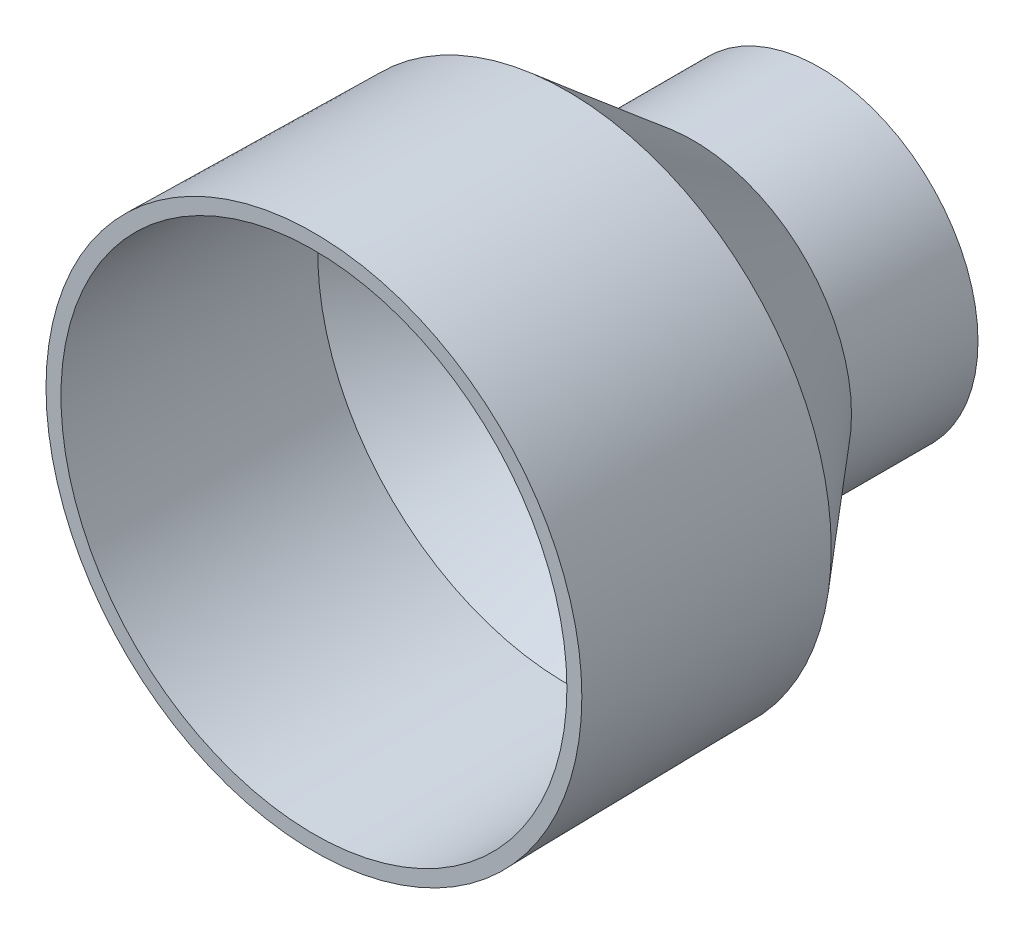
from build123d import *


with BuildPart() as part:
    # Sketch3 → Revolve1 (revolve)
    with BuildSketch(Plane(origin=(0, 0, 0), x_dir=(0, 0, -1), z_dir=(1, 0, 0)), mode=Mode.PRIVATE) as revolve1_sk:
        Polygon((0, 50.8), (50.8, 50.038), (76.2, 28.575), (101.6, 28.575), (101.6, 31.75), (76.2, 31.75), (50.844994938, 53.037662557), (0.044994938, 53.799662557), (0, 53.800337481), align=None)
    revolve(revolve1_sk.sketch.rotate(Axis((0, 0, 0), (0, 0, -1)), 90), axis=Axis((0, 0, 0), (0, 0, -1)))


solid = part.part
